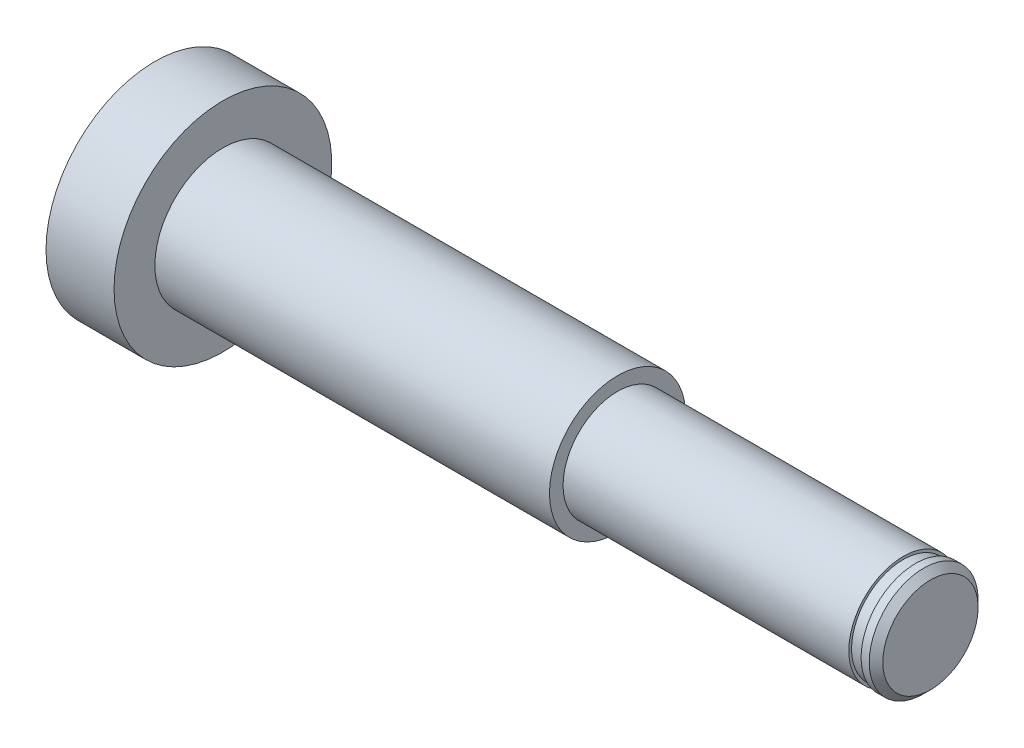
from build123d import *

# Parameters (mm, degrees)
CHAMFER_1_SIZE = 0.5


with BuildPart() as part:
    # Эскиз1 → Повернуть1 (revolve)
    with BuildSketch(Plane.XY, mode=Mode.PRIVATE) as revolve_1_sk:
        Polygon((50.9, 4), (52, 4), (52, 0), (0, 0), (-5, 0), (-5, 8), (0, 8), (0, 5), (29, 5), (29, 4), (50, 4), (50, 3.8), (50.9, 3.8), align=None)
    revolve(revolve_1_sk.sketch.rotate(Axis((0, 0, 0), (1, 0, 0)), 90), axis=Axis((0, 0, 0), (1, 0, 0)))

    # Фаска1
    chamfer_1_edges = [part.edges().sort_by_distance(p)[0] for p in [
        (52, 0, -4),
    ]]
    chamfer(chamfer_1_edges, length=CHAMFER_1_SIZE)


solid = part.part
